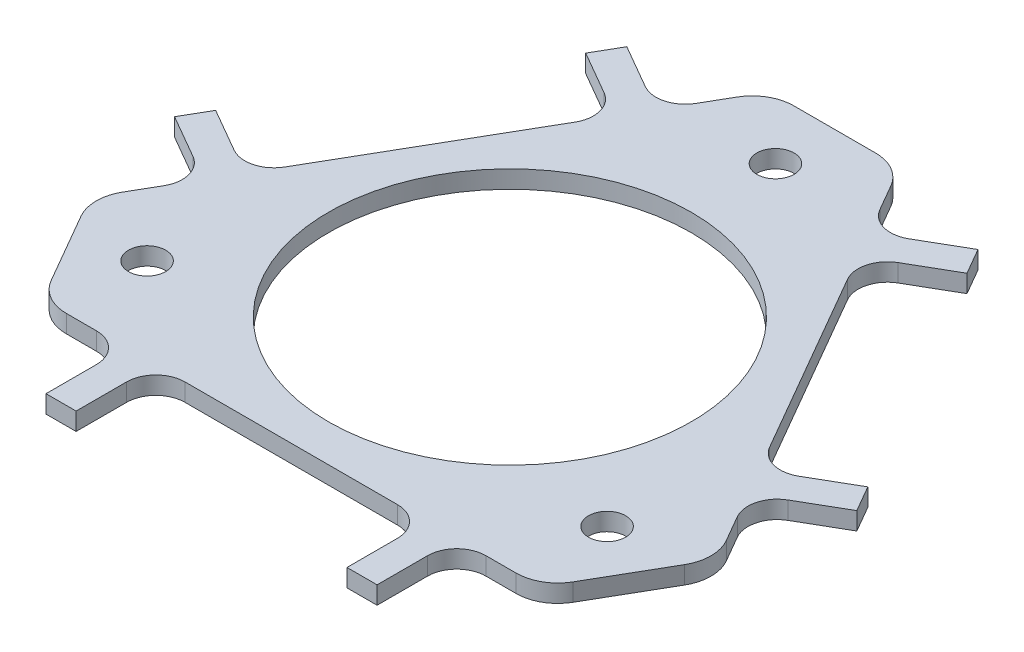
from build123d import *

# Parameters (mm, degrees)
BOSS_EXTRUDE1_DEPTH = 2
SKETCH4_R           = 2.1
CUT_EXTRUDE1_DEPTH  = 105.611811864
SKETCH5_R           = 20.5
CUT_EXTRUDE2_DEPTH  = 105.611811864


with BuildPart() as part:
    # Sketch1 → Boss-Extrude1 (new body)
    with BuildSketch(Plane(origin=(0, 0, 0), x_dir=(1, 0, 0), z_dir=(0, 1, 0))):
        with BuildLine():
            Line((49.096295698, 65.225835767), (47.394589776, 68.173276884))
            ThreePointArc((47.394589776, 68.173276884), (45.674270378, 69.893596282), (43.324270378, 70.523276884))
            Line((43.324270378, 70.523276884), (34.086666071, 70.523276884))
            ThreePointArc((34.086666071, 70.523276884), (31.736666071, 69.893596282), (30.016346673, 68.173276884))
            Line((30.016346673, 68.173276884), (28.314640751, 65.225835767))
            ThreePointArc((28.314640751, 65.225835767), (26.310859767, 63.688280541), (23.806756919, 64.017951935))
            Line((23.806756919, 64.017951935), (18.870412117, 66.867951935))
            Line((18.870412117, 66.867951935), (17.170412117, 63.923465562))
            Line((17.170412117, 63.923465562), (22.106756919, 61.073465562))
            ThreePointArc((22.106756919, 61.073465562), (23.644312145, 59.069684578), (23.314640751, 56.565581729))
            Line((23.314640751, 56.565581729), (11.314640751, 35.780972039))
            ThreePointArc((11.314640751, 35.780972039), (9.310859767, 34.243416812), (6.806756919, 34.573088206))
            Line((6.806756919, 34.573088206), (1.870412117, 37.423088206))
            Line((1.870412117, 37.423088206), (0.170412117, 34.478601833))
            Line((0.170412117, 34.478601833), (5.106756919, 31.628601833))
            ThreePointArc((5.106756919, 31.628601833), (6.644312145, 29.62482085), (6.314640751, 27.120718001))
            Line((6.314640751, 27.120718001), (4.612934829, 24.173276884))
            ThreePointArc((4.612934829, 24.173276884), (3.983254227, 21.823276884), (4.612934829, 19.473276884))
            Line((4.612934829, 19.473276884), (9.231736982, 11.473276884))
            ThreePointArc((9.231736982, 11.473276884), (10.95205638, 9.752957486), (13.30205638, 9.123276884))
            Line((13.30205638, 9.123276884), (16.705468225, 9.123276884))
            ThreePointArc((16.705468225, 9.123276884), (19.038920602, 8.156729262), (20.005468225, 5.823276884))
            Line((20.005468225, 5.823276884), (20.005468225, 0.123276884))
            Line((20.005468225, 0.123276884), (23.405468225, 0.123276884))
            Line((23.405468225, 0.123276884), (23.405468225, 5.823276884))
            ThreePointArc((23.405468225, 5.823276884), (24.372015847, 8.156729262), (26.705468225, 9.123276884))
            Line((26.705468225, 9.123276884), (50.705468225, 9.123276884))
            ThreePointArc((50.705468225, 9.123276884), (53.038920602, 8.156729262), (54.005468225, 5.823276884))
            Line((54.005468225, 5.823276884), (54.005468225, 0.123276884))
            Line((54.005468225, 0.123276884), (57.405468225, 0.123276884))
            Line((57.405468225, 0.123276884), (57.405468225, 5.823276884))
            ThreePointArc((57.405468225, 5.823276884), (58.372015847, 8.156729262), (60.705468225, 9.123276884))
            Line((60.705468225, 9.123276884), (64.108880069, 9.123276884))
            ThreePointArc((64.108880069, 9.123276884), (66.458880069, 9.752957486), (68.179199467, 11.473276884))
            Line((68.179199467, 11.473276884), (72.79800162, 19.473276884))
            ThreePointArc((72.79800162, 19.473276884), (73.427682222, 21.823276884), (72.79800162, 24.173276884))
            Line((72.79800162, 24.173276884), (71.096295698, 27.120718001))
            ThreePointArc((71.096295698, 27.120718001), (70.766624304, 29.62482085), (72.304179531, 31.628601833))
            Line((72.304179531, 31.628601833), (77.240524332, 34.478601833))
            Line((77.240524332, 34.478601833), (75.540524332, 37.423088206))
            Line((75.540524332, 37.423088206), (70.604179531, 34.573088206))
            ThreePointArc((70.604179531, 34.573088206), (68.100076682, 34.243416812), (66.096295698, 35.780972039))
            Line((66.096295698, 35.780972039), (54.096295698, 56.565581729))
            ThreePointArc((54.096295698, 56.565581729), (53.766624304, 59.069684578), (55.304179531, 61.073465562))
            Line((55.304179531, 61.073465562), (60.240524332, 63.923465562))
            Line((60.240524332, 63.923465562), (58.540524332, 66.867951935))
            Line((58.540524332, 66.867951935), (53.604179531, 64.017951935))
            ThreePointArc((53.604179531, 64.017951935), (51.100076682, 63.688280541), (49.096295698, 65.225835767))
        make_face()
    extrude(amount=BOSS_EXTRUDE1_DEPTH)

    # Sketch4 → Cut-Extrude1 (cut, through all)
    with BuildSketch(Plane(origin=(0, 2, 0), x_dir=(1, 0, 0), z_dir=(0, 1, 0))):
        with Locations(Location((38.705468225, 63.823276884, 0), (0, 0, 270))):
            Circle(SKETCH4_R)
        with Locations(Location((12.724706111, 18.823276884, 0), (0, 0, 270))):
            Circle(SKETCH4_R)
        with Locations(Location((64.686230338, 18.823276884, 0), (0, 0, 270))):
            Circle(SKETCH4_R)
    extrude(amount=-CUT_EXTRUDE1_DEPTH, mode=Mode.SUBTRACT)

    # Sketch5 → Cut-Extrude2 (cut, through all)
    with BuildSketch(Plane(origin=(0, 2, 0), x_dir=(1, 0, 0), z_dir=(0, 1, 0))):
        with Locations(Location((38.705468225, 33.823276884, 0), (0, 0, 270))):
            Circle(SKETCH5_R)
    extrude(amount=-CUT_EXTRUDE2_DEPTH, mode=Mode.SUBTRACT)


solid = part.part
